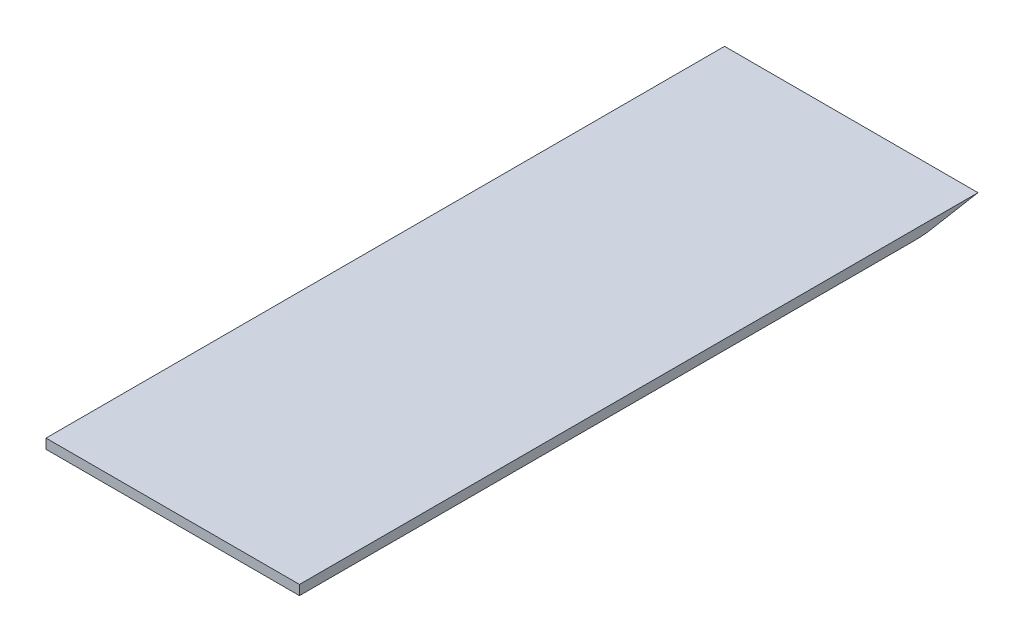
from build123d import *

# Parameters (mm, degrees)
BOSS_EXTRUDE1_DEPTH = 130
FILLET1_R           = 50


with BuildPart() as part:
    # Sketch1 → Boss-Extrude1 (new body)
    with BuildSketch(Plane(origin=(0, 0, 0), x_dir=(0, 0, -1), z_dir=(1, 0, 0))):
        Polygon((0, 5), (0, 0), (320, 0), (348, 5), align=None)
    extrude(amount=BOSS_EXTRUDE1_DEPTH)

    # Fillet1
    fillet1_edges = [part.edges().sort_by_distance(p)[0] for p in [
        (65, 0, -320),
    ]]
    fillet(fillet1_edges, radius=FILLET1_R)


solid = part.part
